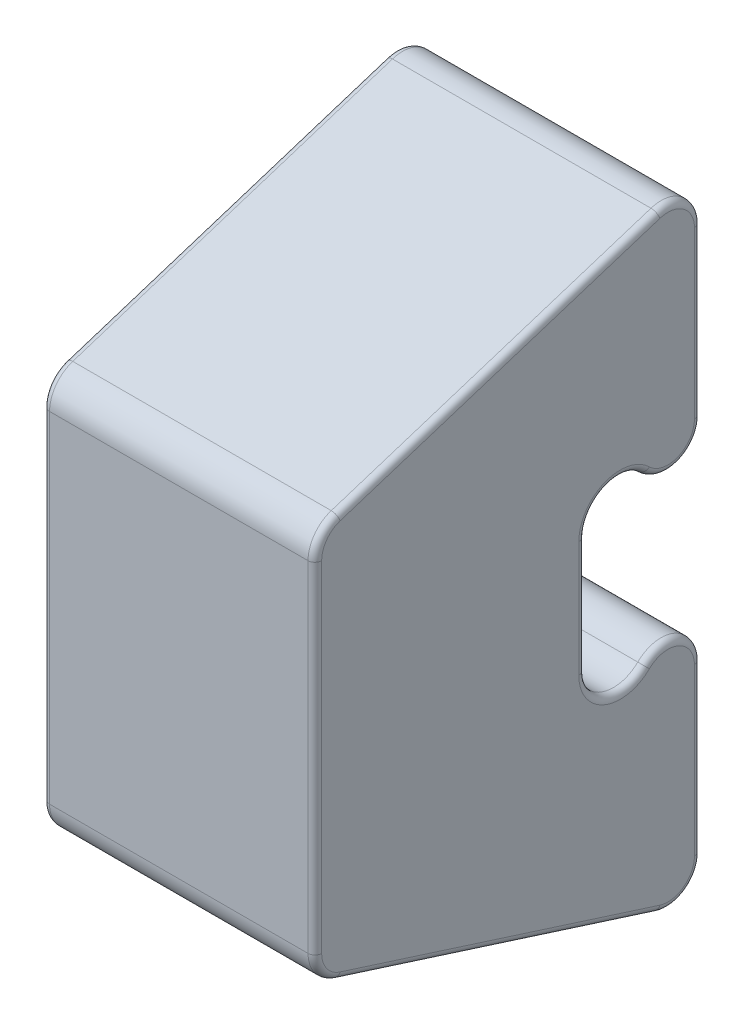
from build123d import *

# Parameters (mm, degrees)
BOSS_EXTRUDE1_DEPTH      = 1
BOSS_EXTRUDE1_DEPTH_BACK = 3
FILLET1_R                = 0.1


with BuildPart() as part:
    # Sketch3 → Boss-Extrude1 (new, two sides: drawn at the far end of the back side and taken through both)
    with BuildSketch(Plane.YZ.offset(-BOSS_EXTRUDE1_DEPTH_BACK)):
        with BuildLine():
            Line((-4, 5.31), (-1.56416825, 5.31))
            ThreePointArc((-1.56416825, 5.31), (-1.112410571, 5.610223816), (-1.214238257, 6.143))
            ThreePointArc((-1.214238257, 6.143), (-1.320222174, 6.697522151), (-0.850025407, 7.01))
            Line((-0.850025407, 7.01), (0.850025407, 7.01))
            ThreePointArc((0.850025407, 7.01), (1.320222174, 6.697522151), (1.214238257, 6.143))
            ThreePointArc((1.214238257, 6.143), (1.112410571, 5.610223816), (1.56416825, 5.31))
            Line((1.56416825, 5.31), (4, 5.31))
            ThreePointArc((4, 5.31), (4.395664028, 5.510949871), (4.466803013, 5.948979685))
            Line((4.466803013, 5.948979685), (2.966803013, 10.648979685))
            ThreePointArc((2.966803013, 10.648979685), (2.789050129, 10.895664028), (2.5, 10.99))
            Line((2.5, 10.99), (-2.5, 10.99))
            ThreePointArc((-2.5, 10.99), (-2.789050129, 10.895664028), (-2.966803013, 10.648979685))
            Line((-2.966803013, 10.648979685), (-4.466803013, 5.948979685))
            ThreePointArc((-4.466803013, 5.948979685), (-4.395664028, 5.510949871), (-4, 5.31))
        make_face()
    extrude(amount=BOSS_EXTRUDE1_DEPTH + BOSS_EXTRUDE1_DEPTH_BACK)

    # Fillet1
    fillet1_edges = [part.edges().sort_by_distance(p)[0] for p in [
        (-3, -1.112410571, 5.610223816),
        (-3, -1.320222174, 6.697522151),
        (-3, 0, 7.01),
        (-3, 1.320222174, 6.697522151),
        (-3, 1.112410571, 5.610223816),
        (-3, 2.782084125, 5.31),
        (-3, 4.395664028, 5.510949871),
        (1, -4.395664028, 5.510949871),
        (1, -2.782084125, 5.31),
        (1, -1.112410571, 5.610223816),
        (1, -1.320222174, 6.697522151),
        (-3, 3.716803013, 8.298979685),
        (1, 0, 7.01),
        (1, 1.320222174, 6.697522151),
        (1, 1.112410571, 5.610223816),
        (1, 2.782084125, 5.31),
        (1, 4.395664028, 5.510949871),
        (1, 3.716803013, 8.298979685),
        (1, 2.789050129, 10.895664028),
        (1, 0, 10.99),
        (1, -2.789050129, 10.895664028),
        (1, -3.716803013, 8.298979685),
        (-3, 2.789050129, 10.895664028),
        (-3, 0, 10.99),
        (-3, -4.395664028, 5.510949871),
        (-3, -2.789050129, 10.895664028),
        (-3, -3.716803013, 8.298979685),
        (-3, -2.782084125, 5.31),
    ]]
    fillet(fillet1_edges, radius=FILLET1_R)


solid = part.part
